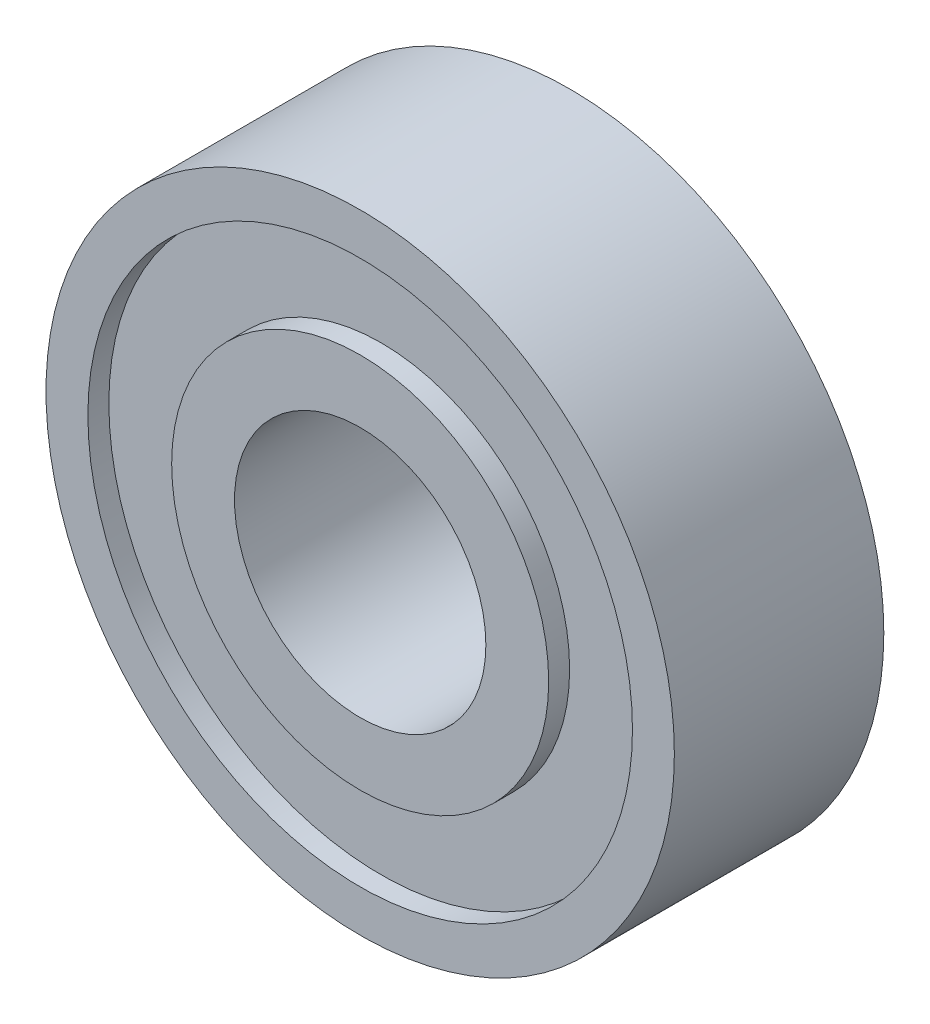
from build123d import *

# Parameters (mm, degrees)
SKETCH_1_R          = 7.5
SKETCH_1_R_2        = 3
EXTRUDE_1_DEPTH     = 5
SKETCH_2_R          = 6.5
SKETCH_2_R_2        = 4.5
CUT_EXTRUDE_1_DEPTH = 0.5
CUT_EXTRUDE_START   = -0.5
SKETCH_3_R          = 6.5
SKETCH_3_R_2        = 4.5
CUT_EXTRUDE_2_DEPTH = 0.5


with BuildPart() as part:
    # 스케치1 → 보스-돌출1 (new body)
    with BuildSketch(Plane.XY):
        Circle(SKETCH_1_R)
        Circle(SKETCH_1_R_2, mode=Mode.SUBTRACT)
    extrude(amount=EXTRUDE_1_DEPTH)

    # 스케치2 → 컷-돌출1 (cut)
    with BuildSketch(Plane.XY.offset(5)):
        Circle(SKETCH_2_R)
        Circle(SKETCH_2_R_2, mode=Mode.SUBTRACT)
    extrude(amount=-CUT_EXTRUDE_1_DEPTH, mode=Mode.SUBTRACT)

    # 스케치3 → 컷-돌출2 (cut)
    with BuildSketch(Plane(origin=(0, 0, 0), x_dir=(-1, 0, 0), z_dir=(0, 0, -1)).offset(CUT_EXTRUDE_START)):
        with Locations(Location((0, 0, 0), (0, 0, 180))):
            Circle(SKETCH_3_R)
        with Locations(Location((0, 0, 0), (0, 0, 180))):
            Circle(SKETCH_3_R_2, mode=Mode.SUBTRACT)
    extrude(amount=CUT_EXTRUDE_2_DEPTH, mode=Mode.SUBTRACT)


solid = part.part
